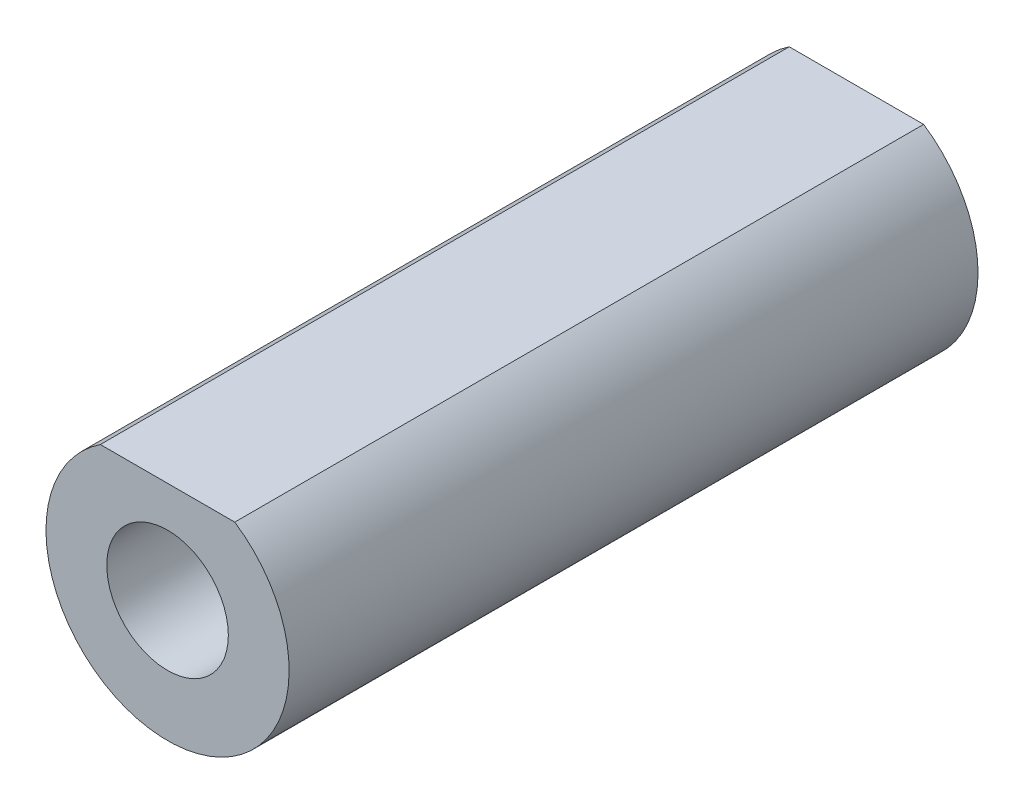
from build123d import *

# Parameters (mm, degrees)
SKETCH_1_R      = 3
EXTRUDE_1_DEPTH = 34


with BuildPart() as part:
    # 草图1 → 凸台-拉伸1 (new body)
    with BuildSketch(Plane.XY):
        with BuildLine():
            Line((0, 5), (3.31662479, 5))
            ThreePointArc((3.31662479, 5), (0, -6), (-3.31662479, 5))
            Line((-3.31662479, 5), (0, 5))
        make_face()
        Circle(SKETCH_1_R, mode=Mode.SUBTRACT)
    extrude(amount=EXTRUDE_1_DEPTH)


solid = part.part
